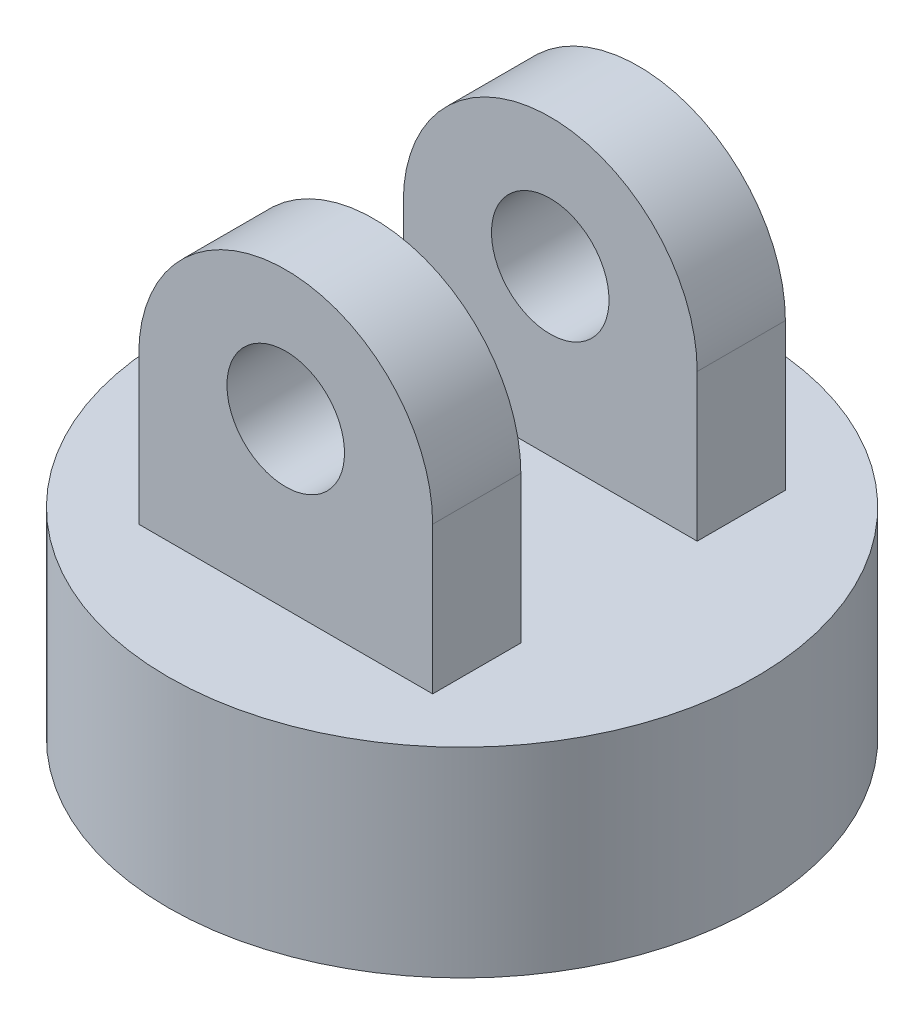
from build123d import *

# Parameters (mm, degrees)
CROQUIS1_R              = 50
SALIENTE_EXTRUIR1_DEPTH = 34
CROQUIS2_W              = 50
CROQUIS2_H              = 15
SALIENTE_EXTRUIR2_DEPTH = 50
CROQUIS4_R              = 10
CORTAR_EXTRUIR1_DEPTH   = 60
REDONDEO1_RADIUS        = 25
REDONDEO1_LENGTH        = 15
REDONDEO2_RADIUS        = 25
REDONDEO2_LENGTH        = 15


with BuildPart() as part:
    # Croquis1 → Saliente-Extruir1 (new body)
    with BuildSketch(Plane(origin=(0, 0, 0), x_dir=(1, 0, 0), z_dir=(0, 1, 0))):
        with Locations(Location((0, 0, 0), (0, 0, 270))):
            Circle(CROQUIS1_R)
    extrude(amount=SALIENTE_EXTRUIR1_DEPTH)

    # Croquis2 → Saliente-Extruir2 (add)
    with BuildSketch(Plane(origin=(0, 34, 0), x_dir=(1, 0, 0), z_dir=(0, 1, 0))):
        with Locations((0, 22.5)):
            Rectangle(CROQUIS2_W, CROQUIS2_H)
        with Locations((0, -22.5)):
            Rectangle(CROQUIS2_W, CROQUIS2_H)
    extrude(amount=SALIENTE_EXTRUIR2_DEPTH)

    # Croquis4 → Cortar-Extruir1 (cut)
    with BuildSketch(Plane(origin=(0, 0, -30), x_dir=(-1, 0, 0), z_dir=(0, 0, -1))):
        with Locations((0, 62)):
            Circle(CROQUIS4_R)
    extrude(amount=-CORTAR_EXTRUIR1_DEPTH, mode=Mode.SUBTRACT)

    # Redondeo1: full round fillet: the end face becomes a half cylinder, R = half its width
    redondeo1_face = Plane((0, 84, -22.5), x_dir=(0, 0, 1), z_dir=(0, 1, 0))  # on the end face: x along it, z out of the body
    redondeo1_slab = redondeo1_face.offset(-REDONDEO1_RADIUS / 2) * Box(REDONDEO1_LENGTH, 2 * REDONDEO1_RADIUS, REDONDEO1_RADIUS, mode=Mode.PRIVATE)  # the body's end, R deep
    redondeo1_round = Plane((0, 59, -22.5), x_dir=(0, 1, 0), z_dir=(0, 0, 1)) * Cylinder(REDONDEO1_RADIUS, REDONDEO1_LENGTH, mode=Mode.PRIVATE)  # its axis R under the face
    add(redondeo1_slab - redondeo1_round, mode=Mode.SUBTRACT)

    # Redondeo2: full round fillet: the end face becomes a half cylinder, R = half its width
    redondeo2_face = Plane((0, 84, 22.5), x_dir=(0, 0, 1), z_dir=(0, 1, 0))  # on the end face: x along it, z out of the body
    redondeo2_slab = redondeo2_face.offset(-REDONDEO2_RADIUS / 2) * Box(REDONDEO2_LENGTH, 2 * REDONDEO2_RADIUS, REDONDEO2_RADIUS, mode=Mode.PRIVATE)  # the body's end, R deep
    redondeo2_round = Plane((0, 59, 22.5), x_dir=(0, 1, 0), z_dir=(0, 0, 1)) * Cylinder(REDONDEO2_RADIUS, REDONDEO2_LENGTH, mode=Mode.PRIVATE)  # its axis R under the face
    add(redondeo2_slab - redondeo2_round, mode=Mode.SUBTRACT)


solid = part.part
